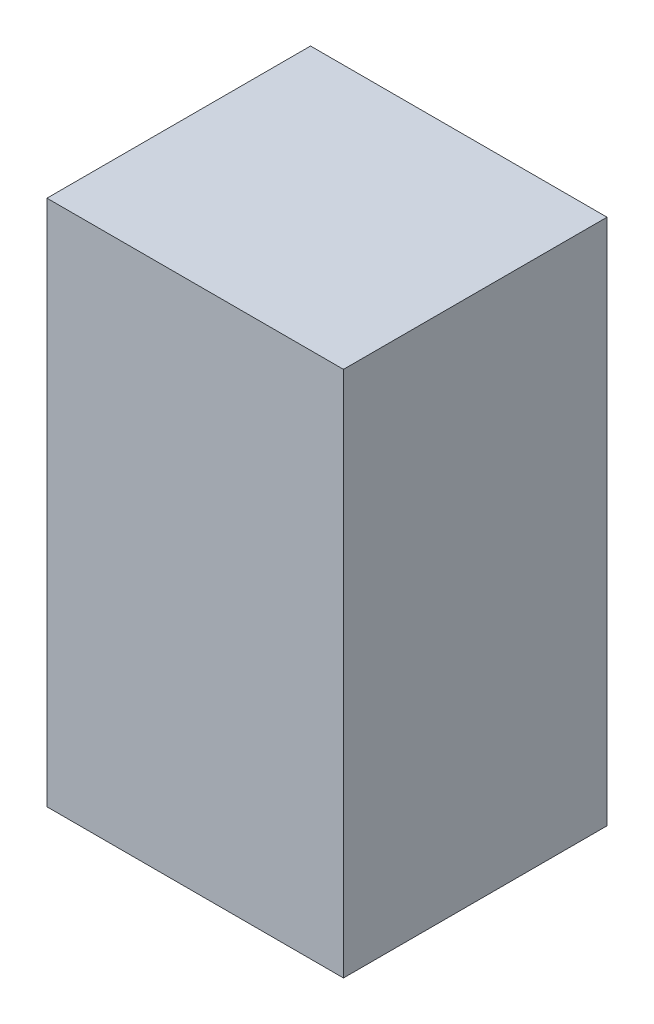
from build123d import *

# Parameters (mm, degrees)
OVEN_PANO_SSR_2_1_START = -208
SKETCH1_W               = 45
SKETCH1_H               = 80
OVEN_PANO_SSR_2_1_DEPTH = 40


with BuildPart() as part:
    # Sketch1 → OVEN_pano_SSR_2_1 (new body)
    with BuildSketch(Plane.XY.offset(OVEN_PANO_SSR_2_1_START)):
        with Locations((602.5, 260)):
            Rectangle(SKETCH1_W, SKETCH1_H)
    extrude(amount=-OVEN_PANO_SSR_2_1_DEPTH)


solid = part.part
